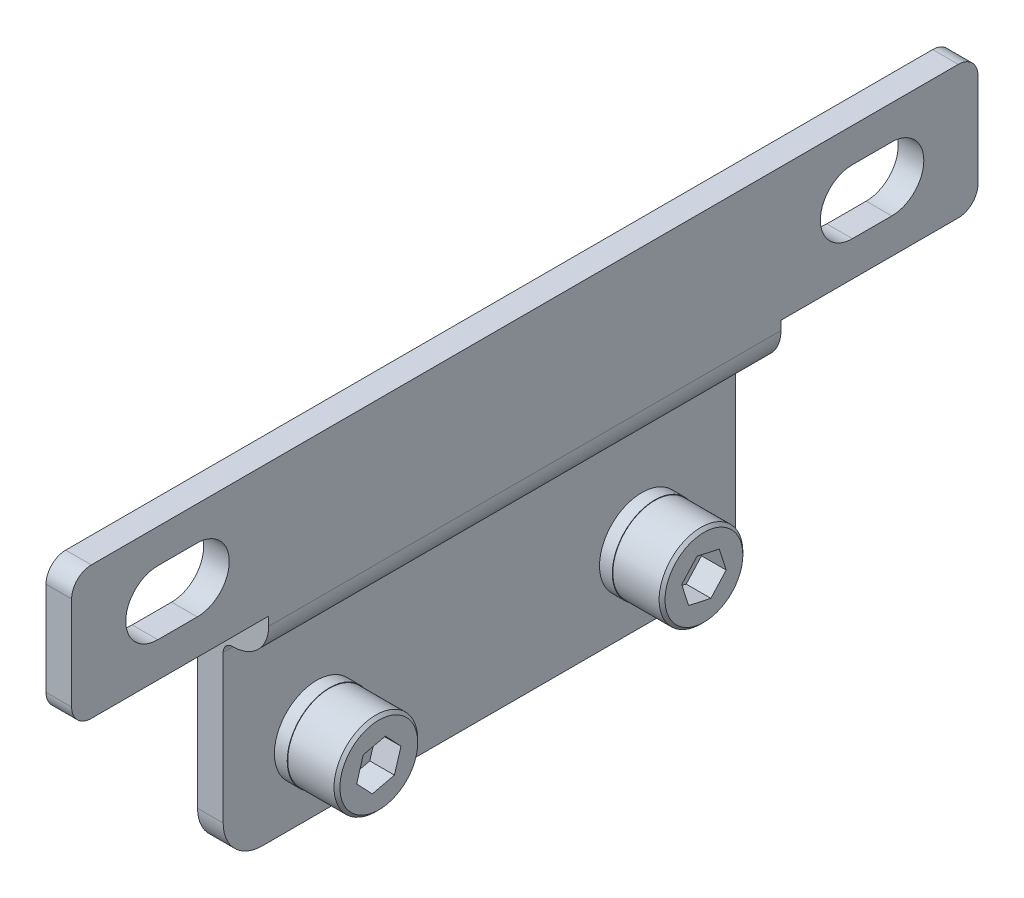
from build123d import *

# Parameters (mm, degrees)
BOSS_EXTRUDE1_DEPTH = 46
CUT_EXTRUDE1_REACH  = 62.101
SKETCH2_W           = 20
SKETCH2_H           = 24.5
FILLET1_R           = 2
FILLET2_R           = 4
CUT_EXTRUDE2_REACH  = 62.101
SKETCH4_R           = 4.3
BOSS_EXTRUDE2_DEPTH = 1.3
SKETCH5_R           = 4.25
BOSS_EXTRUDE3_DEPTH = 5
CHAMFER1_SIZE       = 0.3
CUT_EXTRUDE3_DEPTH  = 2.5


with BuildPart() as part:
    # Sketch1 → Boss-Extrude1 (new, symmetric)
    with BuildSketch(Plane.XY):
        with BuildLine():
            Line((0, 0), (2.6, 0))
            Line((2.6, 0), (2.6, 19))
            ThreePointArc((2.6, 19), (2.892893219, 19.707106781), (3.6, 20))
            Line((3.6, 20), (3.618034897, 20))
            ThreePointArc((3.618034897, 20), (6.16361931, 21.054415588), (7.218034897, 23.6))
            Line((7.218034897, 23.6), (7.218034897, 38))
            Line((7.218034897, 38), (4.618034897, 38))
            Line((4.618034897, 38), (4.618034897, 23.6))
            ThreePointArc((4.618034897, 23.6), (4.325141678, 22.892893219), (3.618034897, 22.6))
            Line((3.618034897, 22.6), (3.6, 22.6))
            ThreePointArc((3.6, 22.6), (1.054415588, 21.545584412), (0, 19))
            Line((0, 19), (0, 0))
        make_face()
    extrude(amount=BOSS_EXTRUDE1_DEPTH, both=True)

    # Sketch2 → Cut-Extrude1 (cut, up to next)
    with BuildSketch(Plane(origin=(7.218034897, 0, 0), x_dir=(0, 0, -1), z_dir=(1, 0, 0)), mode=Mode.PRIVATE) as cut_extrude1_sk1:
        with Locations((-36, 12.25)):
            Rectangle(SKETCH2_W, SKETCH2_H)
    cut_extrude1_tool1 = extrude(cut_extrude1_sk1.sketch, amount=-CUT_EXTRUDE1_REACH, mode=Mode.PRIVATE) & part.part
    # Sketch2 → Cut-Extrude1 (cut, up to next)
    with BuildSketch(Plane(origin=(7.218034897, 0, 0), x_dir=(0, 0, -1), z_dir=(1, 0, 0)), mode=Mode.PRIVATE) as cut_extrude1_sk2:
        with Locations((36, 12.25)):
            Rectangle(SKETCH2_W, SKETCH2_H)
    cut_extrude1_tool2 = extrude(cut_extrude1_sk2.sketch, amount=-CUT_EXTRUDE1_REACH, mode=Mode.PRIVATE) & part.part
    add(cut_extrude1_tool1.solids().sort_by_distance((7.218035, 12.25, 36))[0], mode=Mode.SUBTRACT)
    add(cut_extrude1_tool2.solids().sort_by_distance((7.218035, 12.25, -36))[0], mode=Mode.SUBTRACT)

    # Fillet1
    fillet1_edges = [part.edges().sort_by_distance(p)[0] for p in [
        (5.918034897, 38, -46),
        (5.918034897, 38, 46),
        (5.918034897, 24.5, 46),
        (5.918034897, 24.5, -46),
    ]]
    fillet(fillet1_edges, radius=FILLET1_R)

    # Fillet2
    fillet2_edges = [part.edges().sort_by_distance(p)[0] for p in [
        (1.3, 0, 26),
        (1.3, 0, -26),
    ]]
    fillet(fillet2_edges, radius=FILLET2_R)

    # Sketch3 → Cut-Extrude2 (cut, up to next)
    with BuildSketch(Plane(origin=(7.218034897, 0, 0), x_dir=(0, 0, -1), z_dir=(1, 0, 0)), mode=Mode.PRIVATE) as cut_extrude2_sk1:
        with BuildLine():
            Line((-37.25, 34.55), (-33.25, 34.55))
            ThreePointArc((-33.25, 34.55), (-30, 31.3), (-33.25, 28.05))
            Line((-33.25, 28.05), (-37.25, 28.05))
            ThreePointArc((-37.25, 28.05), (-40.5, 31.3), (-37.25, 34.55))
        make_face()
    cut_extrude2_tool1 = extrude(cut_extrude2_sk1.sketch, amount=-CUT_EXTRUDE2_REACH, mode=Mode.PRIVATE) & part.part
    # Sketch3 → Cut-Extrude2 (cut, up to next)
    with BuildSketch(Plane(origin=(7.218034897, 0, 0), x_dir=(0, 0, -1), z_dir=(1, 0, 0)), mode=Mode.PRIVATE) as cut_extrude2_sk2:
        with BuildLine():
            Line((37.25, 34.55), (33.25, 34.55))
            ThreePointArc((33.25, 34.55), (30, 31.3), (33.25, 28.05))
            Line((33.25, 28.05), (37.25, 28.05))
            ThreePointArc((37.25, 28.05), (40.5, 31.3), (37.25, 34.55))
        make_face()
    cut_extrude2_tool2 = extrude(cut_extrude2_sk2.sketch, amount=-CUT_EXTRUDE2_REACH, mode=Mode.PRIVATE) & part.part
    add(cut_extrude2_tool1.solids().sort_by_distance((7.218035, 31.3, 35.25))[0], mode=Mode.SUBTRACT)
    add(cut_extrude2_tool2.solids().sort_by_distance((7.218035, 31.3, -35.25))[0], mode=Mode.SUBTRACT)

    # Sketch4 → Boss-Extrude2 (add)
    with BuildSketch(Plane(origin=(2.6, 0, 0), x_dir=(0, 0, -1), z_dir=(1, 0, 0))):
        with Locations(Location((-16.5, 7.5, 0), (0, 0, 180))):
            Circle(SKETCH4_R)
        with Locations(Location((16.5, 7.5, 0), (0, 0, 180))):
            Circle(SKETCH4_R)
    extrude(amount=BOSS_EXTRUDE2_DEPTH)

    # Sketch5 → Boss-Extrude3 (add)
    with BuildSketch(Plane(origin=(3.9, 0, 0), x_dir=(0, 0, -1), z_dir=(1, 0, 0))):
        with Locations((-16.5, 7.5)):
            Circle(SKETCH5_R)
        with Locations((16.5, 7.5)):
            Circle(SKETCH5_R)
    extrude(amount=BOSS_EXTRUDE3_DEPTH)

    # Chamfer1
    chamfer1_edges = [part.edges().sort_by_distance(p)[0] for p in [
        (8.9, 7.5, 20.75),
        (8.9, 7.5, -12.25),
    ]]
    chamfer(chamfer1_edges, length=CHAMFER1_SIZE)

    # Sketch6 → Cut-Extrude3 (cut)
    with BuildSketch(Plane(origin=(8.9, 0, 0), x_dir=(0, 0, -1), z_dir=(1, 0, 0))):
        Polygon((-14.916307537, 5.819151549), (-14.25249631, 8.03109368), (-15.836188773, 9.711942131), (-18.083692463, 9.180848451), (-18.74750369, 6.96890632), (-17.163811227, 5.288057869), align=None)
        Polygon((14.946369576, 5.791326293), (17.202939625, 5.300179731), (18.756570049, 7.008853438), (18.053630424, 9.208673707), (15.797060375, 9.699820269), (14.243429951, 7.991146562), align=None)
    extrude(amount=-CUT_EXTRUDE3_DEPTH, mode=Mode.SUBTRACT)


solid = part.part
